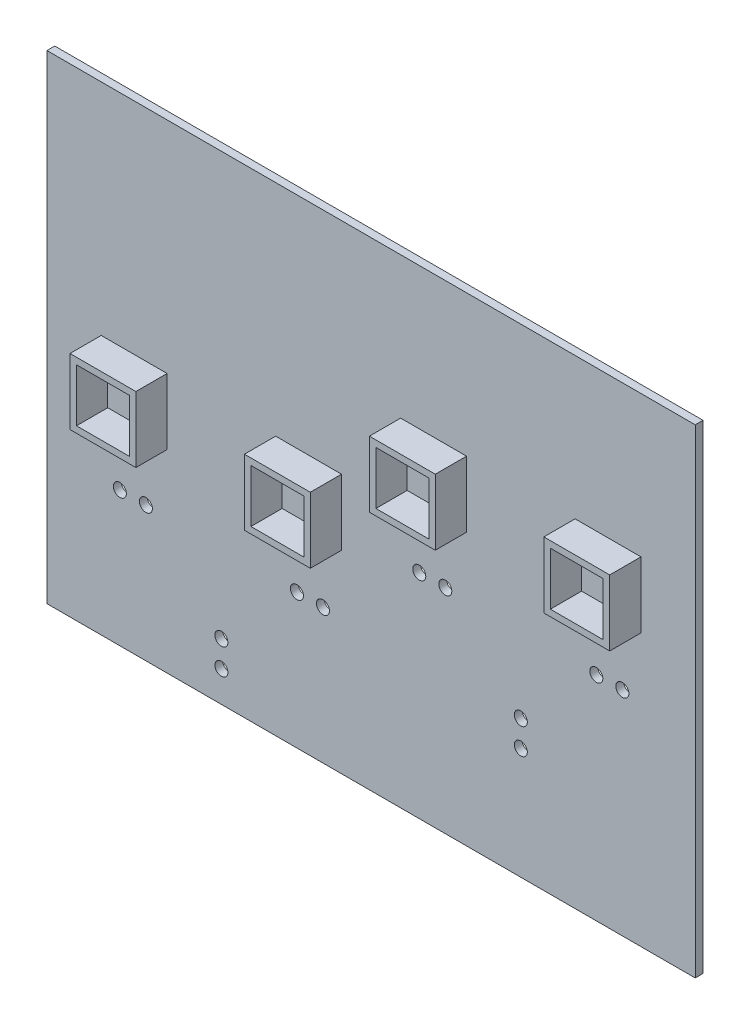
from build123d import *

# Parameters (mm, degrees)
CROQUIS1_W              = 134
CROQUIS1_H              = 54
SALIENTE_EXTRUIR1_DEPTH = 3
CROQUIS2_W              = 25.3
CROQUIS2_H              = 25.3
CROQUIS2_W_2            = 20.3
CROQUIS2_H_2            = 20.3
SALIENTE_EXTRUIR2_DEPTH = 12
CROQUIS4_R              = 2
CORTAR_EXTRUIR1_DEPTH   = 12
CROQUIS5_W              = 115
CROQUIS5_H              = 30
SALIENTE_EXTRUIR3_DEPTH = 3
CROQUIS6_W              = 249
CROQUIS6_H              = 40
CROQUIS6_H_2            = 60
SALIENTE_EXTRUIR4_DEPTH = 3
CROQUIS8_R              = 2.5
CORTAR_EXTRUIR3_DEPTH   = 10


with BuildPart() as part:
    # Croquis1 → Saliente-Extruir1 (new body)
    with BuildSketch(Plane.XY):
        Rectangle(CROQUIS1_W, CROQUIS1_H)
    extrude(amount=SALIENTE_EXTRUIR1_DEPTH)

    # Croquis2 → Saliente-Extruir2 (add)
    # profile 1 of 2: a face of its own
    with BuildSketch(Plane.XY.offset(3)):
        with Locations((-33.5, 0)):
            Rectangle(CROQUIS2_W, CROQUIS2_H)
        with Locations((-33.5, 0)):
            Rectangle(CROQUIS2_W_2, CROQUIS2_H_2, mode=Mode.SUBTRACT)
    # profile 2 of 2: a face of its own
    with BuildSketch(Plane.XY.offset(3)):
        with Locations((33.5, 0)):
            Rectangle(CROQUIS2_W, CROQUIS2_H)
        with Locations((33.5, 0)):
            Rectangle(CROQUIS2_W_2, CROQUIS2_H_2, mode=Mode.SUBTRACT)
    extrude(amount=SALIENTE_EXTRUIR2_DEPTH)


with BuildPart() as body_2:
    # Sólido-Mover/Copiar1: copy of part
    add(part.part.moved(Location((115, 30, 0))))

    # Combinar1: union part
    add(part.part)

    # Croquis4 → Cortar-Extruir1 (cut)
    with BuildSketch(Plane.XY.offset(3)):
        with Locations((-33.5, 0)):
            Circle(CROQUIS4_R)
        with Locations((33.5, 0)):
            Circle(CROQUIS4_R)
        with Locations((81.5, 30)):
            Circle(CROQUIS4_R)
        with Locations((148.5, 30)):
            Circle(CROQUIS4_R)
    extrude(amount=-CORTAR_EXTRUIR1_DEPTH, mode=Mode.SUBTRACT)

    # Croquis5 → Saliente-Extruir3 (add)
    with BuildSketch(Plane.XY.offset(3)):
        with Locations((-9.5, 42)):
            Rectangle(CROQUIS5_W, CROQUIS5_H)
        with Locations((124.5, -12)):
            Rectangle(CROQUIS5_W, CROQUIS5_H)
    extrude(amount=-SALIENTE_EXTRUIR3_DEPTH)

    # Croquis6 → Saliente-Extruir4 (add)
    with BuildSketch(Plane.XY.offset(3)):
        with Locations((57.5, 77)):
            Rectangle(CROQUIS6_W, CROQUIS6_H)
        with Locations((57.5, -57)):
            Rectangle(CROQUIS6_W, CROQUIS6_H_2)
    extrude(amount=-SALIENTE_EXTRUIR4_DEPTH)

    # Croquis8 → Cortar-Extruir3 (cut)
    with BuildSketch(Plane.XY.offset(3)):
        with Locations((144, -5.15)):
            Circle(CROQUIS8_R)
        with Locations((154, -5.15)):
            Circle(CROQUIS8_R)
        with Locations((115, -34.15)):
            Circle(CROQUIS8_R)
        with Locations((115, -44.15)):
            Circle(CROQUIS8_R)
        with Locations(Location((76, -5.15, 0), (0, 0, 180))):
            Circle(CROQUIS8_R)
        with Locations(Location((86, -5.15, 0), (0, 0, 180))):
            Circle(CROQUIS8_R)
        with Locations((-29, -35.15)):
            Circle(CROQUIS8_R)
        with Locations((-39, -35.15)):
            Circle(CROQUIS8_R)
        with Locations((0, -65.15)):
            Circle(CROQUIS8_R)
        with Locations((0, -75.15)):
            Circle(CROQUIS8_R)
        with Locations(Location((39, -35.15, 0), (0, 0, 180))):
            Circle(CROQUIS8_R)
        with Locations(Location((29, -35.15, 0), (0, 0, 180))):
            Circle(CROQUIS8_R)
    extrude(amount=-CORTAR_EXTRUIR3_DEPTH, mode=Mode.SUBTRACT)


solid = body_2.part
